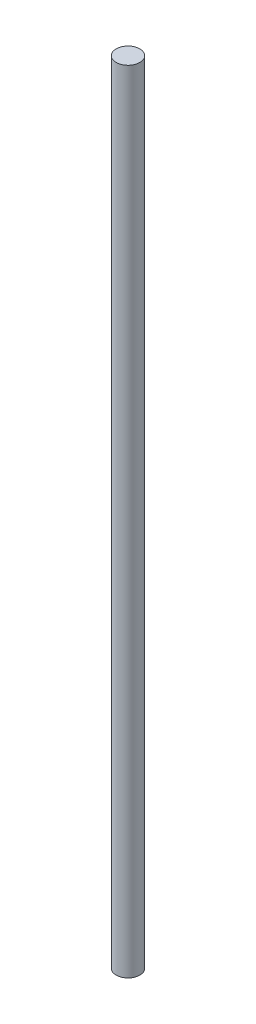
from build123d import *

# Parameters (mm, degrees)
SKETCH_1_R      = 1.5
EXTRUDE_1_DEPTH = 100.4


with BuildPart() as part:
    # Эскиз1 → Бобышка-Вытянуть1 (new body)
    with BuildSketch(Plane(origin=(0, 0, 0), x_dir=(1, 0, 0), z_dir=(0, 1, 0))):
        with Locations(Location((0, 0, 0), (0, 0, 270))):
            Circle(SKETCH_1_R)
    extrude(amount=EXTRUDE_1_DEPTH)


solid = part.part
